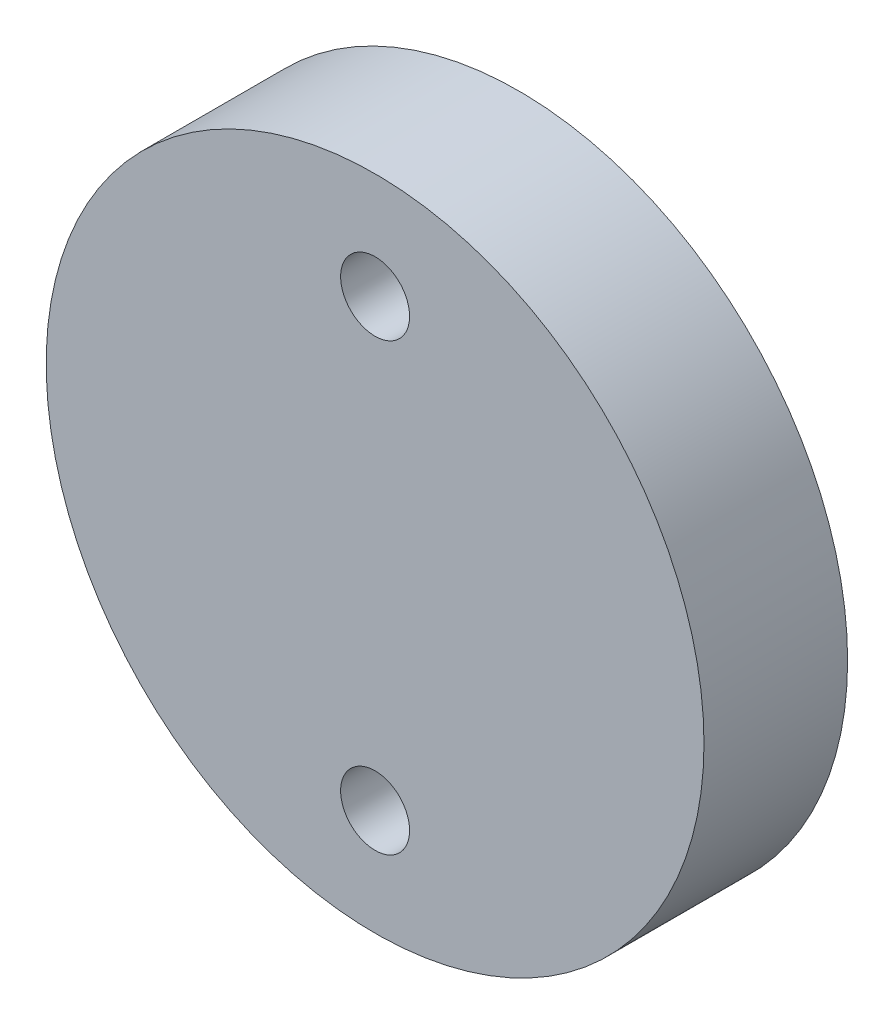
from build123d import *

# Parameters (mm, degrees)
SKETCH1_R           = 11.45
SKETCH1_R_2         = 1.2
BOSS_EXTRUDE1_DEPTH = 5


with BuildPart() as part:
    # Sketch1 → Boss-Extrude1 (new body)
    with BuildSketch(Plane.XY):
        Circle(SKETCH1_R)
        with Locations((0, 7.75)):
            Circle(SKETCH1_R_2, mode=Mode.SUBTRACT)
        with Locations((0, -7.75)):
            Circle(SKETCH1_R_2, mode=Mode.SUBTRACT)
    extrude(amount=BOSS_EXTRUDE1_DEPTH)


solid = part.part
